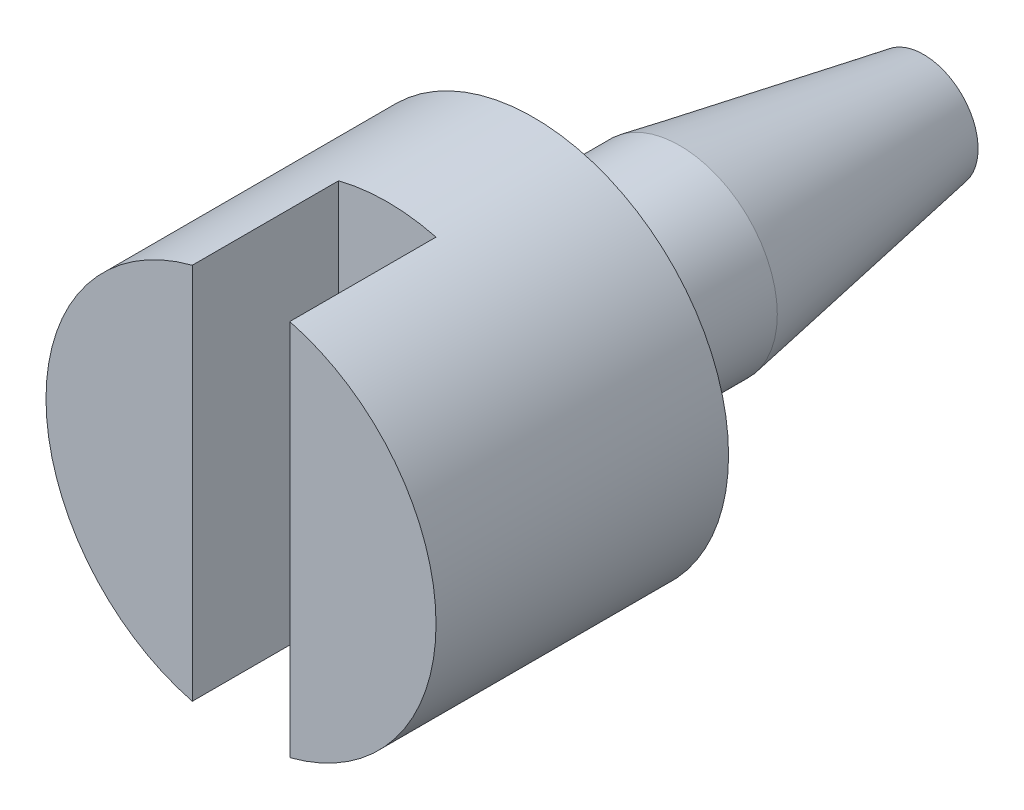
from build123d import *

# Parameters (mm, degrees)
ESQUISSE1_R                     = 2
BASE_EXTRUSION_DEPTH            = 3
ESQUISSE2_R                     = 1
BOSS_EXTRU_1_DEPTH              = 4
CHANFREIN2_SIZE                 = 2.5
CHANFREIN2_SIZE2                = 0.440817452
ESQUISSE3_W                     = 1
ESQUISSE3_H                     = 4.690148878
ENL_V_DE_MAT_EXTRU_MINCE1_DEPTH = 1.5


with BuildPart() as part:
    # Esquisse1 → Base-Extrusion (new body)
    with BuildSketch(Plane.XY):
        Circle(ESQUISSE1_R)
    extrude(amount=BASE_EXTRUSION_DEPTH)

    # Esquisse2 → Boss.-Extru.1 (add)
    with BuildSketch(Plane(origin=(0, 0, 0), x_dir=(-1, 0, 0), z_dir=(0, 0, -1))):
        with Locations(Location((0, 0, 0), (0, 0, 180))):
            Circle(ESQUISSE2_R)
    extrude(amount=BOSS_EXTRU_1_DEPTH)

    # Chanfrein2
    chanfrein2_edges = [part.edges().sort_by_distance(p)[0] for p in [
        (-1, 0, -4),
    ]]
    chanfrein2_side = [part.faces().sort_by_distance(p)[0] for p in [
        (-1, 0, -2),
    ]]
    chamfer(chanfrein2_edges, length=CHANFREIN2_SIZE, length2=CHANFREIN2_SIZE2, reference=chanfrein2_side[0])

    # Esquisse3 → Enlèv. de mat.-Extru.-Mince1 (cut)
    with BuildSketch(Plane.XY.offset(3)):
        with Locations((0, -0.083649642)):
            Rectangle(ESQUISSE3_W, ESQUISSE3_H)
    extrude(amount=-ENL_V_DE_MAT_EXTRU_MINCE1_DEPTH, mode=Mode.SUBTRACT)


solid = part.part
